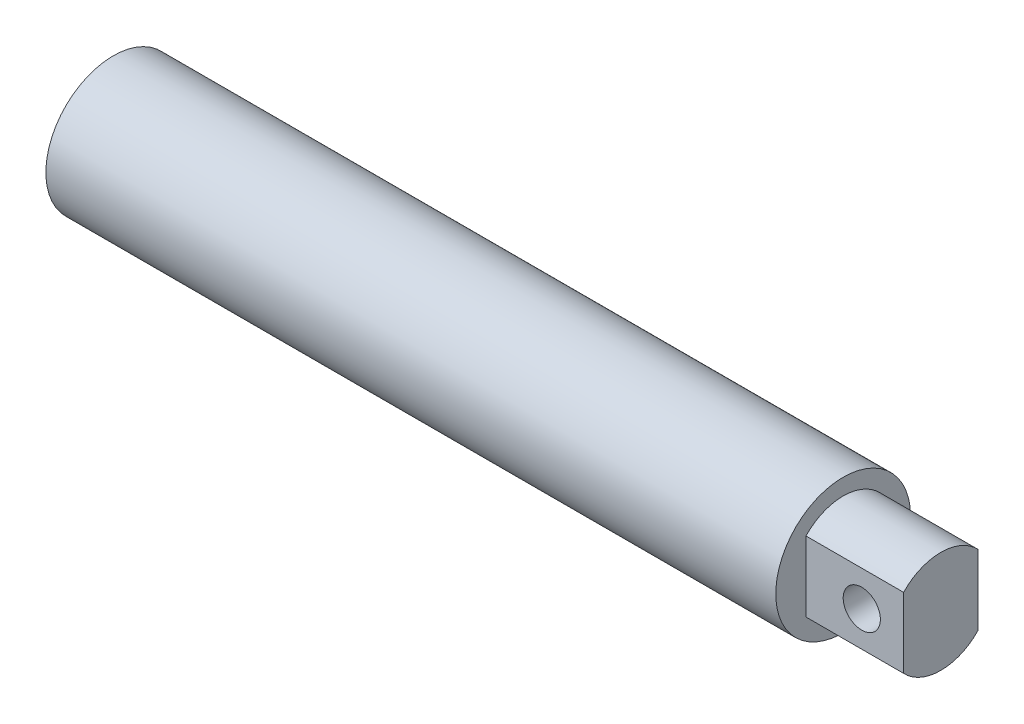
from build123d import *

# Parameters (mm, degrees)
SKETCH_1_R          = 14.5
EXTRUDE_1_DEPTH     = 157
EXTRUDE_2_DEPTH     = 21
SKETCH_3_R          = 4
CUT_EXTRUDE_1_DEPTH = 21
SKETCH_4_R          = 4
CUT_EXTRUDE_2_DEPTH = 80


with BuildPart() as part:
    # 草图1 → 凸台-拉伸1 (new body)
    with BuildSketch(Plane(origin=(0, 0, 0), x_dir=(0, 0, -1), z_dir=(1, 0, 0))):
        Circle(SKETCH_1_R)
    extrude(amount=EXTRUDE_1_DEPTH)

    # 草图2 → 凸台-拉伸2 (add)
    with BuildSketch(Plane(origin=(157, 0, 0), x_dir=(0, 0, -1), z_dir=(1, 0, 0))):
        with BuildLine():
            Line((-8, 7.549834435), (-8, -7.549834435))
            ThreePointArc((-8, -7.549834435), (0, -11), (8, -7.549834435))
            Line((8, -7.549834435), (8, 7.549834435))
            ThreePointArc((8, 7.549834435), (0, 11), (-8, 7.549834435))
        make_face()
    extrude(amount=EXTRUDE_2_DEPTH)

    # 草图3 → 切除-拉伸1 (cut)
    with BuildSketch(Plane.XY.offset(8)):
        with Locations((169, 0)):
            Circle(SKETCH_3_R)
    extrude(amount=-CUT_EXTRUDE_1_DEPTH, mode=Mode.SUBTRACT)

    # 草图4 → 切除-拉伸2 (cut)
    with BuildSketch(Plane.ZY):
        Circle(SKETCH_4_R)
    extrude(amount=-CUT_EXTRUDE_2_DEPTH, mode=Mode.SUBTRACT)


solid = part.part
